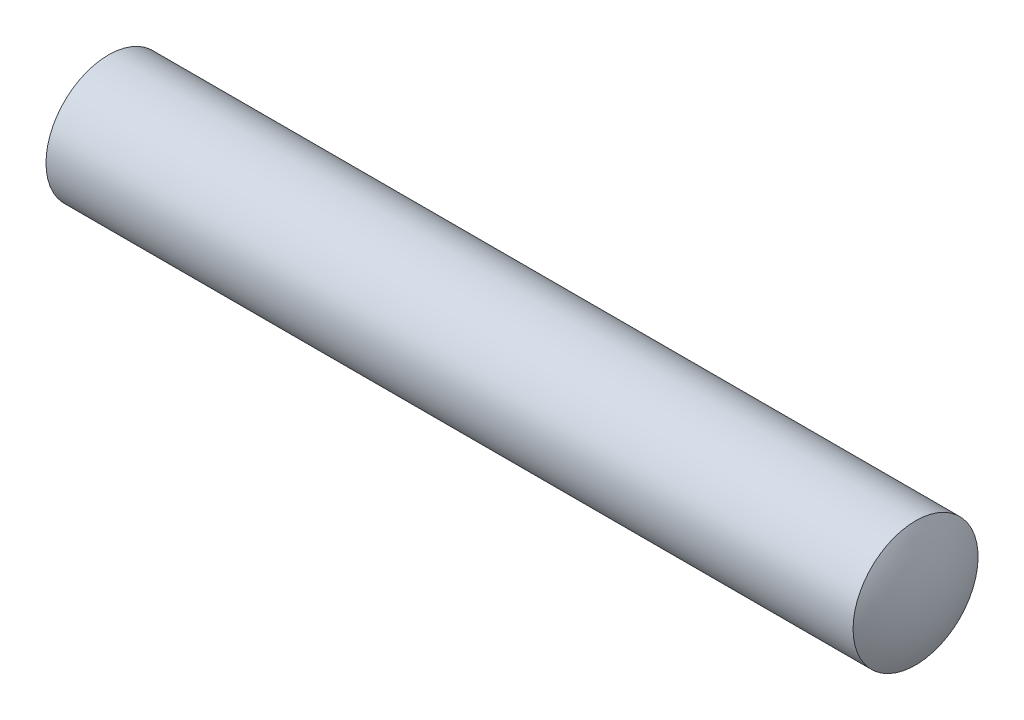
from build123d import *


with BuildPart() as part:
    # Esquisse2 → Base-Révolution (revolve)
    with BuildSketch(Plane.XY):
        with BuildLine():
            Line((0, 0), (40, 0))
            ThreePointArc((40, 0), (39.799268802, 1.538987121), (39.210506213, 2.975))
            Line((39.210506213, 2.975), (0.789493787, 2.975))
            ThreePointArc((0.789493787, 2.975), (0.200731198, 1.538987121), (0, 0))
        make_face()
    revolve(axis=Axis((18, 0, 0), (1, 0, 0)))


solid = part.part
